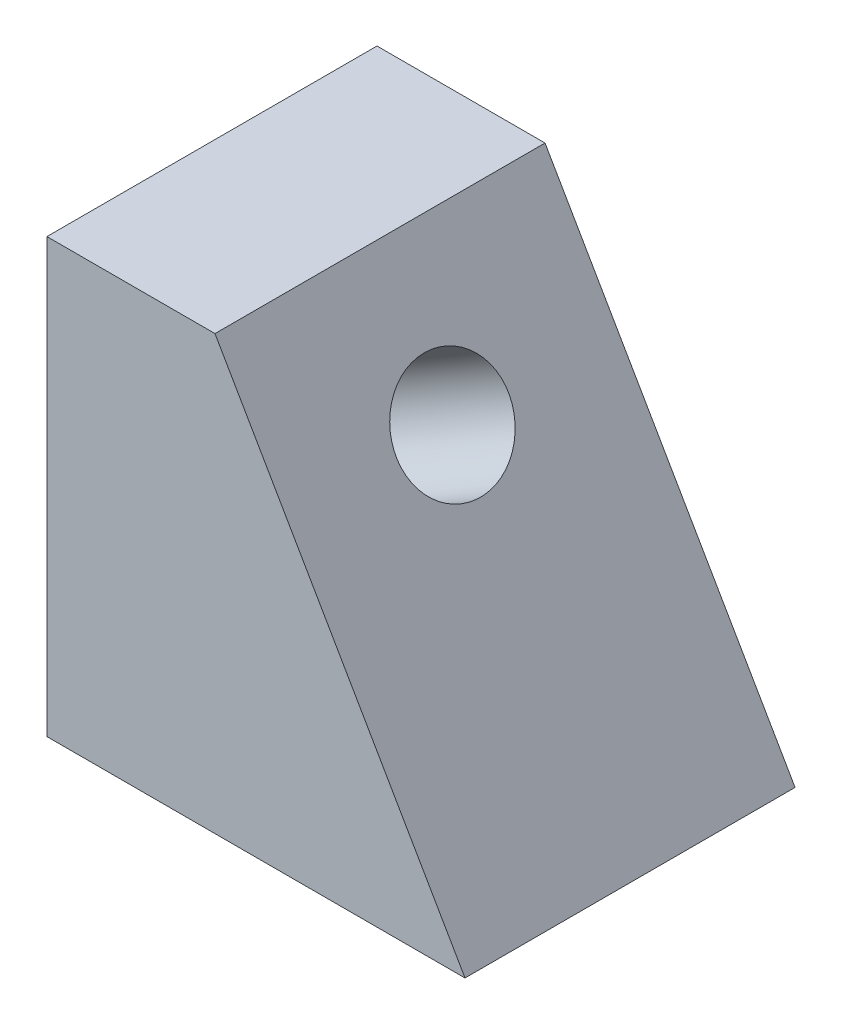
from build123d import *

# Parameters (mm, degrees)
SKETCH1_W           = 63.335064935
SKETCH1_H           = 65.606575703
BOSS_EXTRUDE1_DEPTH = 50
CUT_EXTRUDE1_DEPTH  = 50
CUT_EXTRUDE2_REACH  = 80.83
SKETCH3_R           = 8.5


with BuildPart() as part:
    # Sketch1 → Boss-Extrude1 (new body)
    with BuildSketch(Plane.XY):
        with Locations((31.667532468, 32.803287852)):
            Rectangle(SKETCH1_W, SKETCH1_H)
    extrude(amount=BOSS_EXTRUDE1_DEPTH)

    # Sketch2 → Cut-Extrude1 (cut)
    with BuildSketch(Plane.XY.offset(50)):
        Polygon((25.457090792, 65.606575703), (63.335064935, 0), (63.335064935, 65.606575703), align=None)
    extrude(amount=-CUT_EXTRUDE1_DEPTH, mode=Mode.SUBTRACT)

    # Cut-Extrude2: up to this plane
    cut_extrude2_end = Plane(origin=(0, 0, 50), z_dir=(-1, 0, 0))
    # Sketch3 → Cut-Extrude2 (cut, up to the surface)
    with BuildSketch(Plane(origin=(47.501298701, 27.424887592, 0), x_dir=(0, 0, -1), z_dir=(0.866025403784436, 0.5000000000000043, 0)), mode=Mode.PRIVATE) as cut_extrude2_sk1:
        with Locations(Location((-25, 22.143442983, 0), (0, 0, 90))):
            Circle(SKETCH3_R)
    cut_extrude2_tool1 = split(extrude(cut_extrude2_sk1.sketch, amount=-CUT_EXTRUDE2_REACH, mode=Mode.PRIVATE), bisect_by=cut_extrude2_end, keep=Keep.BOTH, mode=Mode.PRIVATE)
    add(cut_extrude2_tool1.solids().sort_by_distance((36.429577, 46.601672, 25))[0], mode=Mode.SUBTRACT)


solid = part.part
